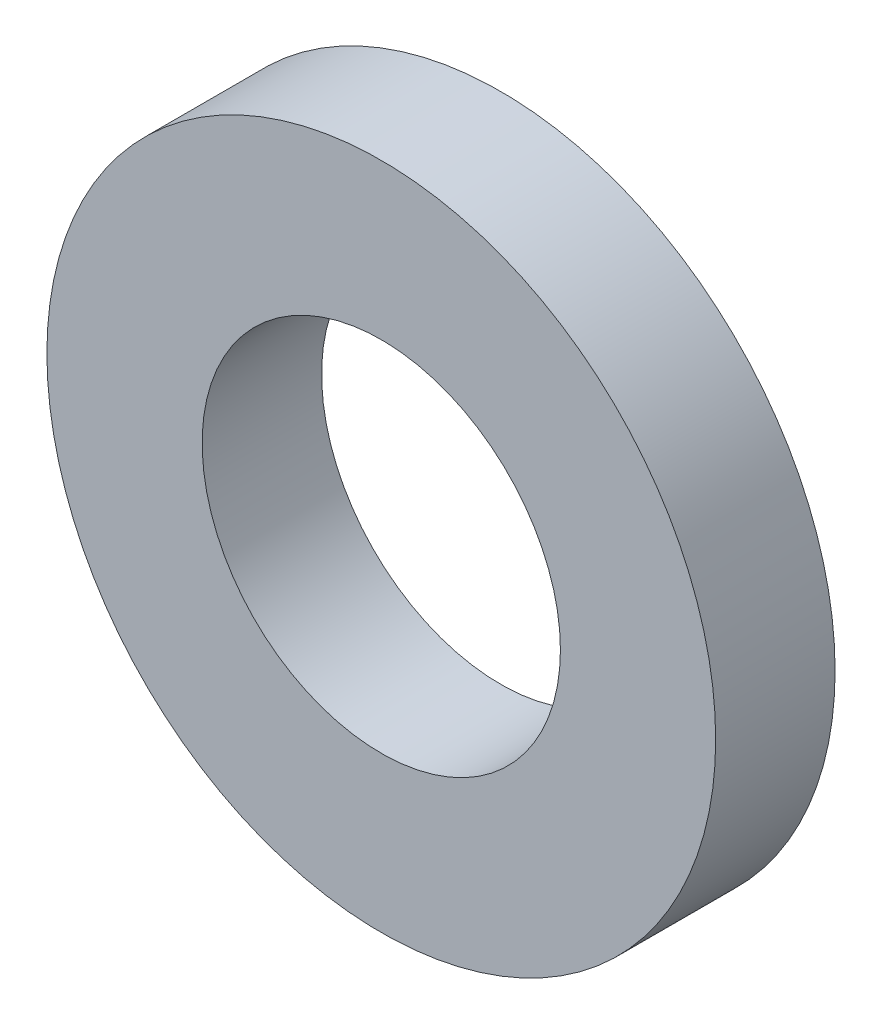
from build123d import *

# Parameters (mm, degrees)
SKETCH1_R           = 14
SKETCH1_R_2         = 7.5
BOSS_EXTRUDE1_DEPTH = 5


with BuildPart() as part:
    # Sketch1 → Boss-Extrude1 (new body)
    with BuildSketch(Plane.XY):
        Circle(SKETCH1_R)
        Circle(SKETCH1_R_2, mode=Mode.SUBTRACT)
    extrude(amount=BOSS_EXTRUDE1_DEPTH)


solid = part.part
